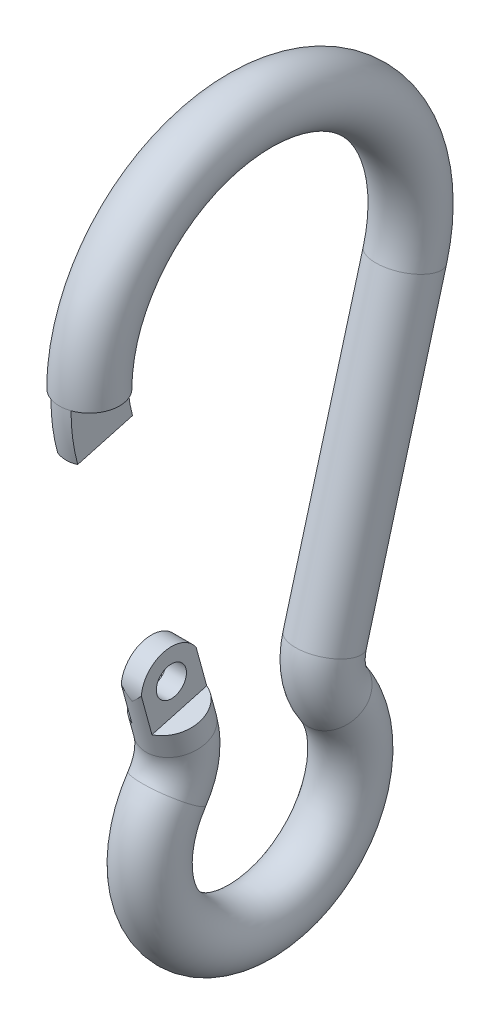
from build123d import *

# Parameters (mm, degrees)
SKETCH2_R               = 3.81
CUT_EXTRUDE3_START      = 1.27
SKETCH7_R               = 1.905
CUT_EXTRUDE3_DEPTH      = 76.130818844
CUT_EXTRUDE4_DEPTH      = 77.400818844
CUT_EXTRUDE4_DEPTH_BACK = 77.400818844
SKETCH7_4_R             = 1.905


with BuildPart() as part:
    # Sweep1: sweep along a path in Sketch1
    with BuildLine(Plane(origin=(0, 0, 0), x_dir=(0, 0, -1), z_dir=(1, 0, 0))) as sweep1_path:
        Line((-8.547525746, -31.307563042), (-5.776082855, -41.432274459))
        ThreePointArc((-5.776082855, -41.432274459), (-5.525966339, -46.328648752), (-7.350227861, -50.879375))
        ThreePointArc((-7.350227861, -50.879375), (0, -64.77), (7.350227861, -50.879375))
        ThreePointArc((7.350227861, -50.879375), (5.525966339, -46.328648752), (5.776082855, -41.432274459))
        Line((5.776082855, -41.432274459), (15.924188179, -4.358936892))
        ThreePointArc((15.924188179, -4.358936892), (2.19906266, 16.362891658), (-16.51, 0))
        ThreePointArc((-16.51, 0), (-16.362891658, -2.19906266), (-15.924188179, -4.358936892))
    # Sketch2 → Sweep1 (sweep)
    with BuildSketch(Plane.XY):
        with Locations((0, 20.32)):
            Circle(SKETCH2_R)
    sweep(path=sweep1_path.line)

    # Sketch7 → Cut-Extrude3 (cut, through all)
    # profile 1 of 2: a face of its own
    with BuildSketch(Plane(origin=(0, 0, 0), x_dir=(0, 0, -1), z_dir=(1, 0, 0)).offset(CUT_EXTRUDE3_START)):
        with BuildLine():
            Line((-16.51, 0), (-24.13, 0))
            ThreePointArc((-24.13, 0), (-23.914995501, -3.214014656), (-23.273813493, -6.37075392))
            Line((-23.273813493, -6.37075392), (-15.924188179, -4.358936892))
            ThreePointArc((-15.924188179, -4.358936892), (-16.362891658, -2.19906266), (-16.51, 0))
        make_face()
    # profile 2 of 2: a face of its own
    with BuildSketch(Plane(origin=(0, 0, 0), x_dir=(0, 0, -1), z_dir=(1, 0, 0)).offset(CUT_EXTRUDE3_START)):
        Polygon((-15.897151059, -33.319380069), (-13.885334032, -40.669005383), (-6.535708719, -38.657188355), (-8.547525746, -31.307563042), align=None)
        with Locations((-11.216429889, -35.988284212)):
            Circle(SKETCH7_R, mode=Mode.SUBTRACT)
    cut_extrude3 = extrude(amount=CUT_EXTRUDE3_DEPTH, mode=Mode.SUBTRACT)

    # Mirror1: Cut-Extrude3 across plane
    add(cut_extrude3.mirror(Plane(origin=(0, 0, 0), x_dir=(0, 0, 1), z_dir=(1, 0, 0))), mode=Mode.SUBTRACT)

    # Sketch7<4> → Cut-Extrude4 (cut, two sides: drawn at the far end of the back side and taken through both)
    with BuildSketch(Plane(origin=(0, 0, 0), x_dir=(0, 0, -1), z_dir=(1, 0, 0)).offset(-CUT_EXTRUDE4_DEPTH_BACK)):
        with BuildLine():
            Line((-12.222338261, -32.313471517), (-15.897151059, -33.319380069))
            Line((-15.897151059, -33.319380069), (-14.891242546, -36.994192726))
            ThreePointArc((-14.891242546, -36.994192726), (-14.526199533, -34.101083931), (-12.222338261, -32.313471517))
        make_face()
        with BuildLine():
            Line((-8.547525746, -31.307563042), (-12.222338261, -32.313471517))
            ThreePointArc((-12.222338261, -32.313471517), (-9.329229607, -32.678514568), (-7.541617232, -34.982375699))
            Line((-7.541617232, -34.982375699), (-8.547525746, -31.307563042))
        make_face()
        with Locations((-11.216429889, -35.988284212)):
            Circle(SKETCH7_4_R)
    extrude(amount=CUT_EXTRUDE4_DEPTH + CUT_EXTRUDE4_DEPTH_BACK, mode=Mode.SUBTRACT)


solid = part.part
